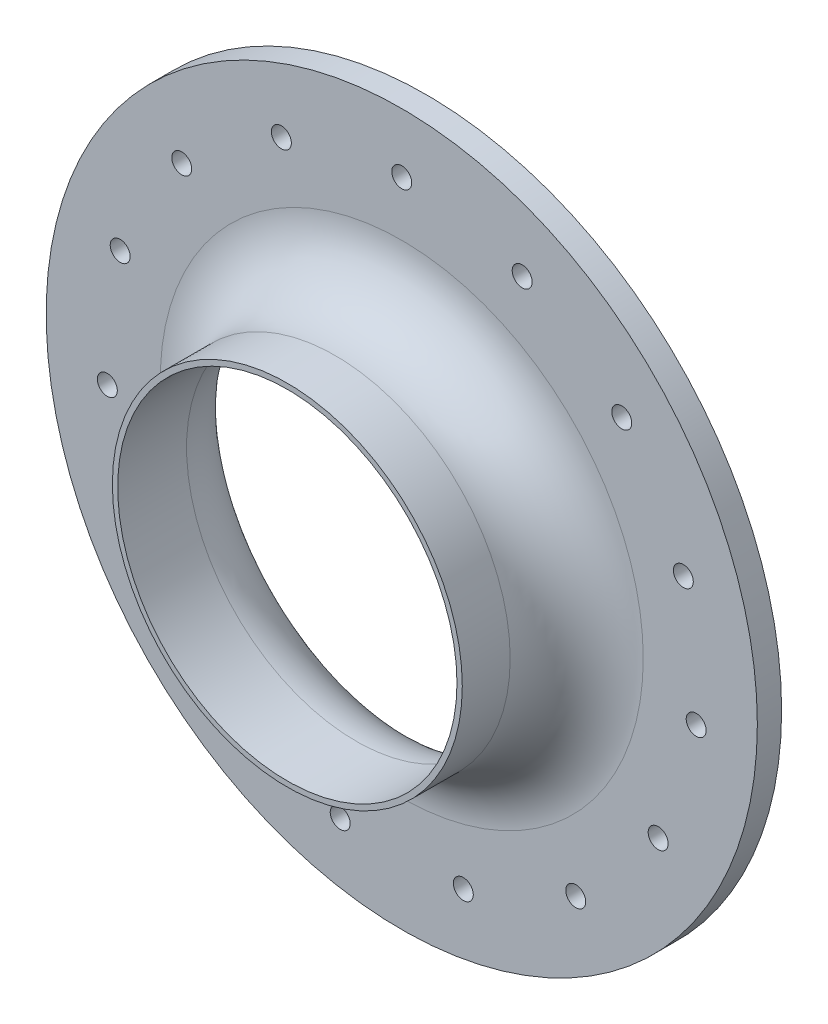
from build123d import *

# Parameters (mm, degrees)
ESQUISSE2_R             = 1.5
ENL_V_MAT_EXTRU_1_DEPTH = 78.521900132


with BuildPart() as part:
    # Esquisse1 → Base-Révolution (revolve)
    with BuildSketch(Plane(origin=(0, 0, 0), x_dir=(0, 0, -1), z_dir=(1, 0, 0)), mode=Mode.PRIVATE) as base_r_volution_sk:
        with BuildLine():
            Line((20.85, 46.5), (20.85, 53.45))
            Line((20.85, 53.45), (17.2, 53.45))
            Line((17.2, 53.45), (17.2, 36.3))
            ThreePointArc((17.2, 36.3), (14.271067812, 29.228932188), (7.2, 26.3))
            Line((7.2, 26.3), (0, 26.3))
            Line((0, 26.3), (0, 25.5))
            Line((0, 25.5), (1.5, 25.5))
            Line((1.5, 25.5), (10.35, 25.5))
            ThreePointArc((10.35, 25.5), (17.774621202, 28.575378798), (20.85, 36))
            Line((20.85, 36), (20.85, 46.5))
        make_face()
    revolve(base_r_volution_sk.sketch.rotate(Axis((0, 0, 0), (0, 0, -1)), 90), axis=Axis((0, 0, 0), (0, 0, -1)))

    # Esquisse2 → Enlèv. mat.-Extru.1 (cut, through all)
    with BuildSketch(Plane.XY.offset(-17.2)):
        with Locations((0, 44.5)):
            Circle(ESQUISSE2_R)
        with Locations((18.099780617, 40.652772865)):
            Circle(ESQUISSE2_R)
        with Locations((33.069944734, 29.776311983)):
            Circle(ESQUISSE2_R)
        with Locations((42.322014975, 13.75125625)):
            Circle(ESQUISSE2_R)
        with Locations((44.256224344, -4.651516615)):
            Circle(ESQUISSE2_R)
        with Locations((38.538130468, -22.25)):
            Circle(ESQUISSE2_R)
        with Locations((26.156443727, -36.00125625)):
            Circle(ESQUISSE2_R)
        with Locations((9.252070241, -43.527568233)):
            Circle(ESQUISSE2_R)
        with Locations((-9.252070241, -43.527568233)):
            Circle(ESQUISSE2_R)
        with Locations((-26.156443727, -36.00125625)):
            Circle(ESQUISSE2_R)
        with Locations((-38.538130468, -22.25)):
            Circle(ESQUISSE2_R)
        with Locations((-44.256224344, -4.651516615)):
            Circle(ESQUISSE2_R)
        with Locations((-42.322014975, 13.75125625)):
            Circle(ESQUISSE2_R)
        with Locations((-33.069944734, 29.776311983)):
            Circle(ESQUISSE2_R)
        with Locations((-18.099780617, 40.652772865)):
            Circle(ESQUISSE2_R)
    extrude(amount=-ENL_V_MAT_EXTRU_1_DEPTH, mode=Mode.SUBTRACT)


solid = part.part
